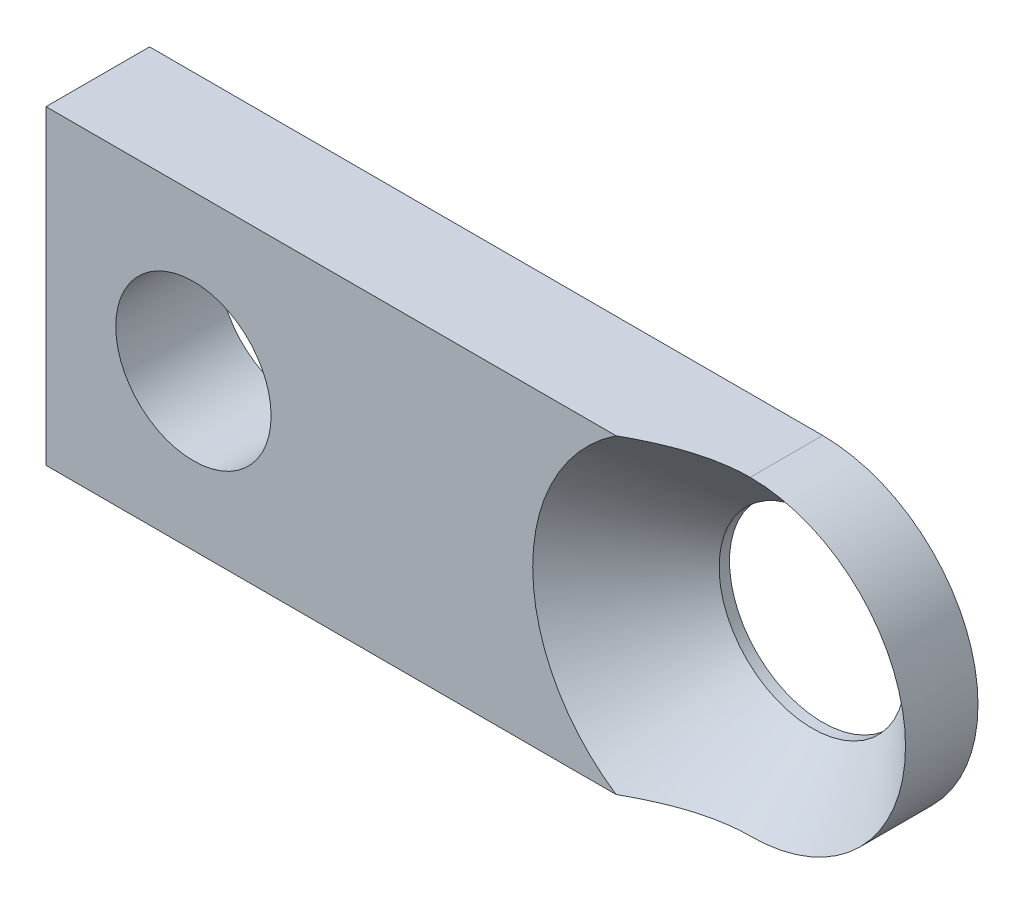
from build123d import *

# Parameters (mm, degrees)
BOSS_EXTRUDE1_DEPTH   = 1
SKETCH3_W             = 1
SKETCH3_H             = 3
BOSS_EXTRUDE2_DEPTH   = 5
F_1_5MM_DOWEL_HOLE1_D = 1.5


with BuildPart() as part:
    # Sketch1 → Boss-Extrude1 (new body)
    with BuildSketch(Plane.XY):
        with BuildLine():
            Line((1.776501472, 1.5), (0.276501472, 1.5))
            Line((0.276501472, 1.5), (0.276501472, -1.5))
            Line((0.276501472, -1.5), (1.776501472, -1.5))
            ThreePointArc((1.776501472, -1.5), (3.276501472, 0), (1.776501472, 1.5))
        make_face()
    extrude(amount=BOSS_EXTRUDE1_DEPTH)

    # Sketch3 → Boss-Extrude2 (add)
    with BuildSketch(Plane.ZY.offset(-0.276501472)):
        with Locations((0.5, 0)):
            Rectangle(SKETCH3_W, SKETCH3_H)
    extrude(amount=BOSS_EXTRUDE2_DEPTH)

    # Ø1.5mm Dowel Hole1 (through all)
    with Locations(Plane(origin=(0, 0, 0), x_dir=(-1, 0, 0), z_dir=(0, 0, -1))):
        with Locations((3.3, 0)):
            Hole(F_1_5MM_DOWEL_HOLE1_D / 2)

    # Sketch8 → CSK SLOT for M1.6 Countersunk Flat Head Screw1 (revolve, cut)
    with BuildSketch(Plane(origin=(1.776501472, 0, 1), x_dir=(0, -1, 0), z_dir=(1, 0, 0))):
        Polygon((0, 0), (0, 1), (0.9, 1), (0.9, 0.9), (1.8, 0), align=None)
    revolve(axis=Axis((1.776501472, 0, 7.35), (0, 0, -1)), mode=Mode.SUBTRACT)


solid = part.part
